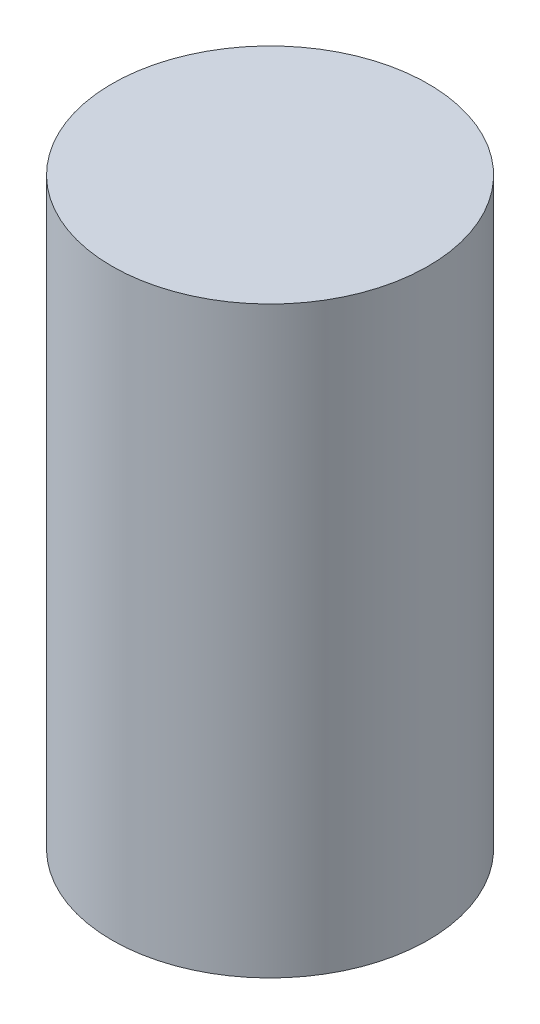
from build123d import *

# Parameters (mm, degrees)
SKETCH1_R           = 32.5
BOSS_EXTRUDE1_DEPTH = 120


with BuildPart() as part:
    # Sketch1 → Boss-Extrude1 (new body)
    with BuildSketch(Plane(origin=(0, 0, 0), x_dir=(1, 0, 0), z_dir=(0, 1, 0))):
        with Locations(Location((0, 0, 0), (0, 0, 270))):
            Circle(SKETCH1_R)
    extrude(amount=BOSS_EXTRUDE1_DEPTH)


solid = part.part
